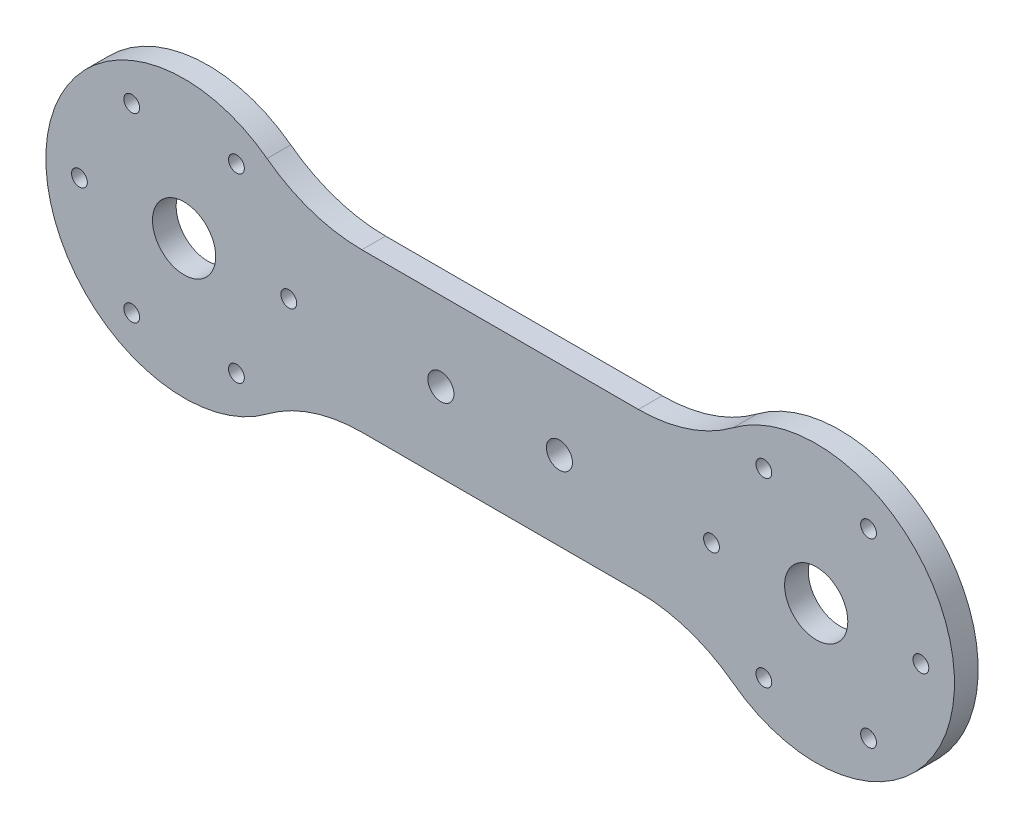
from build123d import *

# Parameters (mm, degrees)
ESBO_O1_R                = 4
ESBO_O1_R_2              = 1
ESBO_O1_R_3              = 1.65
RESSALTO_EXTRUS_O1_DEPTH = 3
FILETE1_R                = 20


with BuildPart() as part:
    # Esboço1 → Ressalto-extrusão1 (new body)
    with BuildSketch(Plane.XY):
        with BuildLine():
            Line((14.361406616, -10), (65.638593384, -10))
            ThreePointArc((65.638593384, -10), (97.5, 0), (65.638593384, 10))
            Line((65.638593384, 10), (14.361406616, 10))
            ThreePointArc((14.361406616, 10), (-17.5, 0), (14.361406616, -10))
        make_face()
        Circle(ESBO_O1_R, mode=Mode.SUBTRACT)
        with Locations((-13.25, 0)):
            Circle(ESBO_O1_R_2, mode=Mode.SUBTRACT)
        with Locations((-6.625, 11.4748366)):
            Circle(ESBO_O1_R_2, mode=Mode.SUBTRACT)
        with Locations((86.625, -11.4748366)):
            Circle(ESBO_O1_R_2, mode=Mode.SUBTRACT)
        with Locations((6.625, 11.4748366)):
            Circle(ESBO_O1_R_2, mode=Mode.SUBTRACT)
        with Locations((80, 0)):
            Circle(ESBO_O1_R, mode=Mode.SUBTRACT)
        with Locations((13.25, 0)):
            Circle(ESBO_O1_R_2, mode=Mode.SUBTRACT)
        with Locations((6.625, -11.4748366)):
            Circle(ESBO_O1_R_2, mode=Mode.SUBTRACT)
        with Locations((-6.625, -11.4748366)):
            Circle(ESBO_O1_R_2, mode=Mode.SUBTRACT)
        with Locations((73.375, -11.4748366)):
            Circle(ESBO_O1_R_2, mode=Mode.SUBTRACT)
        with Locations((66.75, 0)):
            Circle(ESBO_O1_R_2, mode=Mode.SUBTRACT)
        with Locations((73.375, 11.4748366)):
            Circle(ESBO_O1_R_2, mode=Mode.SUBTRACT)
        with Locations((86.625, 11.4748366)):
            Circle(ESBO_O1_R_2, mode=Mode.SUBTRACT)
        with Locations((93.25, 0)):
            Circle(ESBO_O1_R_2, mode=Mode.SUBTRACT)
        with Locations((32.5, 0)):
            Circle(ESBO_O1_R_3, mode=Mode.SUBTRACT)
        with Locations((47.5, 0)):
            Circle(ESBO_O1_R_3, mode=Mode.SUBTRACT)
    extrude(amount=RESSALTO_EXTRUS_O1_DEPTH)

    # Filete1
    filete1_edges = [part.edges().sort_by_distance(p)[0] for p in [
        (65.638593384, -10, 1.5),
        (14.361406616, -10, 1.5),
        (14.361406616, 10, 1.5),
        (65.638593384, 10, 1.5),
    ]]
    fillet(filete1_edges, radius=FILETE1_R)


solid = part.part
